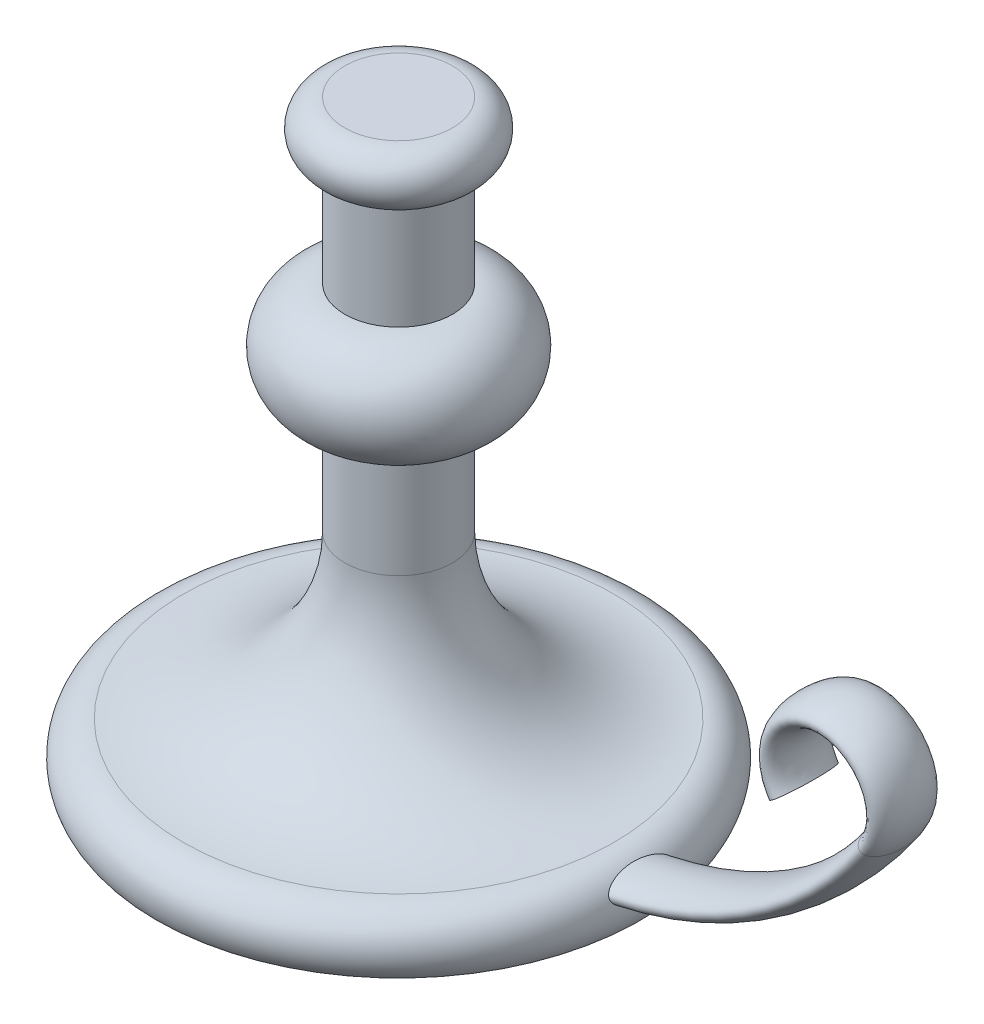
from build123d import *

# Parameters (mm, degrees)
SKETCH3_RX = 12.10799865
SKETCH3_RY = 5


with BuildPart() as part:
    # Sketch1 → Revolve1 (revolve)
    with BuildSketch(Plane.XY, mode=Mode.PRIVATE) as revolve1_sk:
        with BuildLine():
            Line((0, 0), (0, 220))
            Line((0, 220), (20, 220))
            ThreePointArc((20, 220), (30, 210), (20, 200))
            Line((20, 200), (20, 160))
            ThreePointArc((20, 160), (40, 140), (20, 120))
            Line((20, 120), (20, 80))
            ThreePointArc((20, 80), (37.573593129, 37.573593129), (80, 20))
            ThreePointArc((80, 20), (91.180339887, 13.090169944), (90, 0))
            Line((90, 0), (0, 0))
        make_face()
    revolve(revolve1_sk.sketch.rotate(Axis((0, 301.661898631, 0), (0, -1, 0)), 90), axis=Axis((0, 301.661898631, 0), (0, -1, 0)))

    # Sweep1: sweep along a path in Sketch2
    with BuildLine(Plane.XY) as sweep1_path:
        Line((0, 10), (60, 10))
        ThreePointArc((60, 10), (129.821200219, 27.240819526), (183.592070943, 75))
        ThreePointArc((183.592070943, 75), (167.113128151, 106.333333333), (150.634185358, 75))
    # Sketch3 → Sweep1 (sweep)
    with BuildSketch(Plane(origin=(0, 0, 0), x_dir=(0, 0, -1), z_dir=(1, 0, 0))):
        with Locations((0, 10)):
            Ellipse(SKETCH3_RX, SKETCH3_RY)
    sweep(path=sweep1_path.line)


solid = part.part
